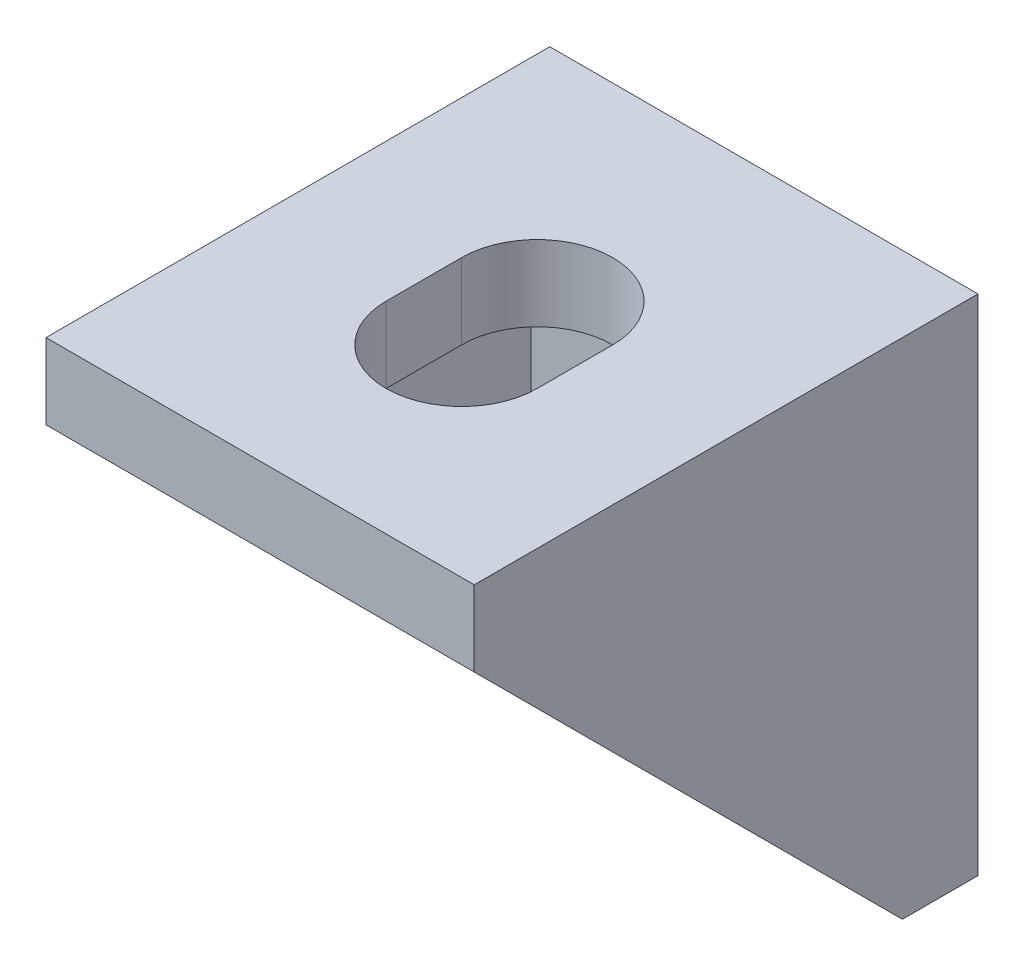
from build123d import *

# Parameters (mm, degrees)
SKETCH_1_W          = 17
SKETCH_1_H          = 20
EXTRUDE_1_DEPTH     = 3
SKETCH_2_W          = 17
SKETCH_2_H          = 3
EXTRUDE_2_DEPTH     = 17
CUT_EXTRUDE_1_DEPTH = 17
EXTRUDE_3_DEPTH     = 2.25
EXTRUDE_4_DEPTH     = 2.25


with BuildPart() as part:
    # Эскиз1 → Бобышка-Вытянуть1 (new body)
    with BuildSketch(Plane.XY):
        with Locations((-20.775029161, -4.314630229)):
            Rectangle(SKETCH_1_W, SKETCH_1_H)
        with BuildLine():
            Line((-17.775029161, -3.314630229), (-17.775029161, -6.314630229))
            ThreePointArc((-17.775029161, -6.314630229), (-20.775029161, -9.314630229), (-23.775029161, -6.314630229))
            Line((-23.775029161, -6.314630229), (-23.775029161, -3.314630229))
            ThreePointArc((-23.775029161, -3.314630229), (-20.775029161, -0.314630229), (-17.775029161, -3.314630229))
        make_face(mode=Mode.SUBTRACT)
    extrude(amount=EXTRUDE_1_DEPTH)

    # Эскиз2 → Бобышка-Вытянуть2 (add)
    with BuildSketch(Plane.XY.offset(3)):
        with Locations((-20.775029161, 4.185369771)):
            Rectangle(SKETCH_2_W, SKETCH_2_H)
    extrude(amount=EXTRUDE_2_DEPTH)

    # Эскиз3 → Вырез-Вытянуть1 (cut)
    with BuildSketch(Plane.XZ.offset(-2.685369771)):
        with BuildLine():
            Line((-17.775029161, 12), (-17.775029161, 9))
            ThreePointArc((-17.775029161, 9), (-20.775029161, 6), (-23.775029161, 9))
            Line((-23.775029161, 9), (-23.775029161, 12))
            ThreePointArc((-23.775029161, 12), (-20.775029161, 15), (-17.775029161, 12))
        make_face()
    extrude(amount=-CUT_EXTRUDE_1_DEPTH, mode=Mode.SUBTRACT)

    # Эскиз4 → Бобышка-Вытянуть3 (add)
    with BuildSketch(Plane.ZY.offset(29.275029161)):
        Polygon((20, 2.685369771), (3, 2.685369771), (3, -14.314630229), align=None)
    extrude(amount=-EXTRUDE_3_DEPTH)

    # Эскиз5 → Бобышка-Вытянуть4 (add)
    with BuildSketch(Plane(origin=(-12.275029161, 0, 0), x_dir=(0, 0, -1), z_dir=(1, 0, 0))):
        Polygon((-3, -14.314630229), (-3, 2.685369771), (-20, 2.685369771), align=None)
    extrude(amount=-EXTRUDE_4_DEPTH)


solid = part.part
